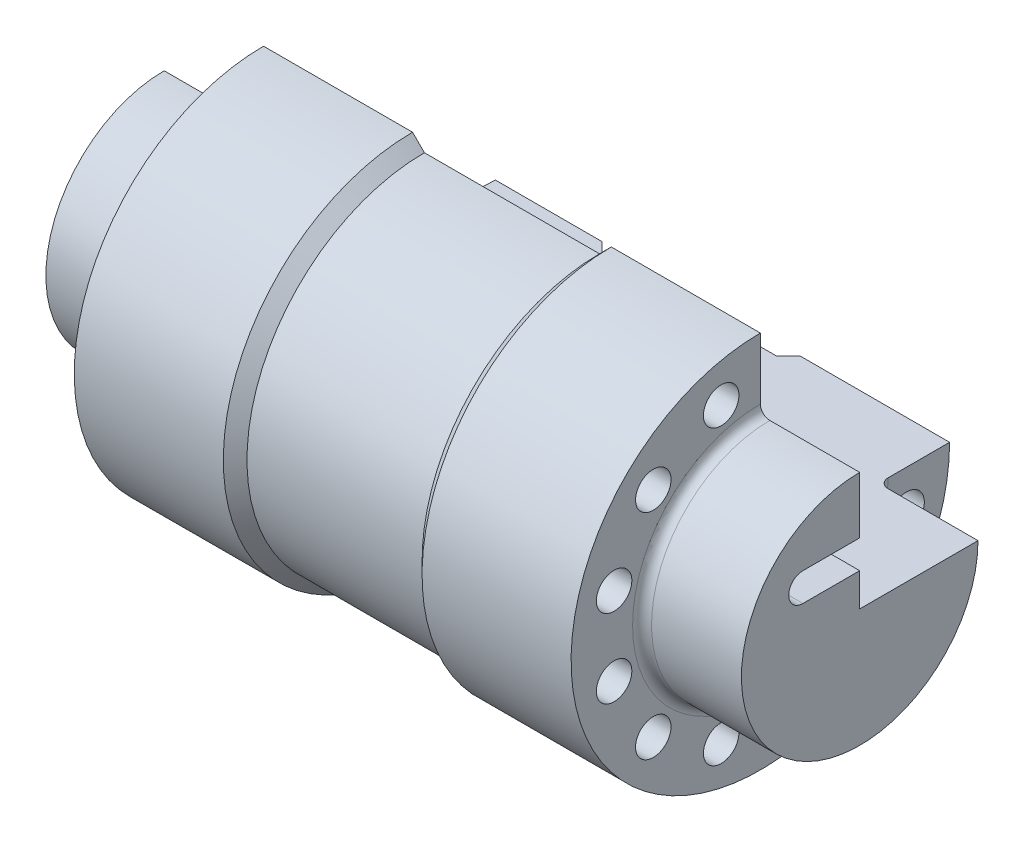
from build123d import *

# Parameters (mm, degrees)
CONG_1_R                     = 2
ENL_V_MAT_EXTRU_1_DEPTH      = 158.508729917
ENL_V_MAT_EXTRU_2_DEPTH      = 158.508729917
ESQUISSE6_R                  = 3.75
ENL_V_MAT_EXTRU_4_DEPTH      = 139.115893365
R_P_TITION_CIRCULAIRE1_COUNT = 9
R_P_TITION_CIRCULAIRE1_ANGLE = 240
ENL_V_MAT_EXTRU_5_DEPTH      = 80


with BuildPart() as part:
    # Esquisse1 → Révolution1 (revolve)
    with BuildSketch(Plane.XY, mode=Mode.PRIVATE) as r_volution1_sk:
        Polygon((0, 0), (0, 25), (21, 25), (21, 40), (52.5, 40), (55, 37.5), (92, 37.5), (94.5, 40), (126, 40), (126, 25), (147, 25), (147, 0), align=None)
    revolve(r_volution1_sk.sketch.rotate(Axis((0, 0, 0), (1, 0, 0)), 90), axis=Axis((0, 0, 0), (1, 0, 0)))

    # Congé1
    cong_1_edges = [part.edges().sort_by_distance(p)[0] for p in [
        (126, 0, -25),
        (21, 0, -25),
    ]]
    fillet(cong_1_edges, radius=CONG_1_R)

    # Esquisse3 → Enlèv. mat.-Extru.1 (cut, through all)
    with BuildSketch(Plane(origin=(147, 0, 0), x_dir=(0, 0, -1), z_dir=(1, 0, 0))):
        with BuildLine():
            Line((0, 0), (0, 40))
            ThreePointArc((0, 40), (28.284271247, 28.284271247), (40, 0))
            Line((40, 0), (0, 0))
        make_face()
    extrude(amount=-ENL_V_MAT_EXTRU_1_DEPTH, mode=Mode.SUBTRACT)

    # Esquisse4 → Enlèv. mat.-Extru.2 (cut, through all)
    with BuildSketch(Plane(origin=(147, 0, 0), x_dir=(0, 0, -1), z_dir=(1, 0, 0))):
        with BuildLine():
            Line((12, 7), (-12, 7))
            ThreePointArc((-12, 7), (-15, 10), (-12, 13))
            Line((-12, 13), (12, 13))
            ThreePointArc((12, 13), (15, 10), (12, 7))
        make_face()
    extrude(amount=-ENL_V_MAT_EXTRU_2_DEPTH, mode=Mode.SUBTRACT)

    # Esquisse6 → Enlèv. mat.-Extru.4 (cut, through all)
    with BuildSketch(Plane(origin=(126, 0, 0), x_dir=(0, 0, -1), z_dir=(1, 0, 0))):
        with Locations((-8.282209443, 30.909626441)):
            Circle(ESQUISSE6_R)
    enl_v_mat_extru_4 = extrude(amount=-ENL_V_MAT_EXTRU_4_DEPTH, mode=Mode.SUBTRACT)

    # Répétition circulaire1: Enlèv. mat.-Extru.4 ×9 about axis
    r_p_tition_circulaire1_axis = Axis((0, 0, 0), (1, 0, 0))
    for i in range(1, R_P_TITION_CIRCULAIRE1_COUNT):
        add(enl_v_mat_extru_4.rotate(r_p_tition_circulaire1_axis, i * R_P_TITION_CIRCULAIRE1_ANGLE / (R_P_TITION_CIRCULAIRE1_COUNT - 1)), mode=Mode.SUBTRACT)

    # Esquisse7 → Enlèv. mat.-Extru.5 (cut)
    with BuildSketch(Plane(origin=(0, 0, 0), x_dir=(1, 0, 0), z_dir=(0, 1, 0))):
        with BuildLine():
            Line((30, 40), (0, 40))
            Line((0, 40), (0, 10))
            ThreePointArc((0, 10), (2.614672282, 10.114159057), (5.20944533, 10.45576741))
            Line((5.20944533, 10.45576741), (6.077686218, 5.531728645))
            ThreePointArc((6.077686218, 5.531728645), (21.306650015, 12.23263309), (31.720772546, 25.208360839))
            Line((31.720772546, 25.208360839), (27.189233611, 27.321452148))
            ThreePointArc((27.189233611, 27.321452148), (29.288880214, 33.506811582), (30, 40))
        make_face()
    extrude(amount=-ENL_V_MAT_EXTRU_5_DEPTH, mode=Mode.SUBTRACT)


solid = part.part
